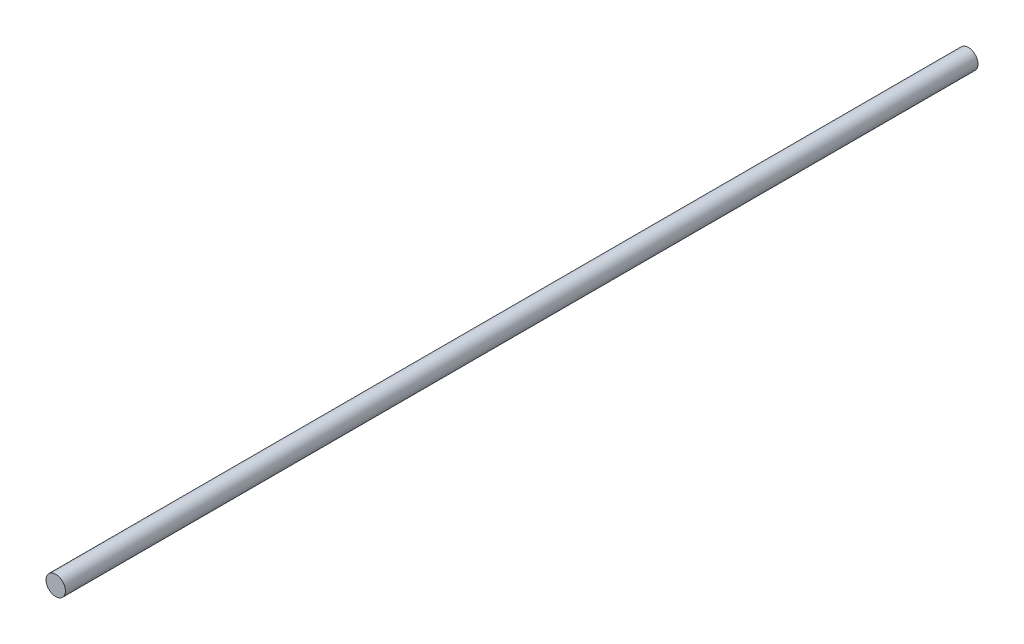
from build123d import *

# Parameters (mm, degrees)
SKETCH1_R           = 6.35
BOSS_EXTRUDE1_DEPTH = 596.9


with BuildPart() as part:
    # Sketch1 → Boss-Extrude1 (new body)
    with BuildSketch(Plane.XY):
        Circle(SKETCH1_R)
    extrude(amount=BOSS_EXTRUDE1_DEPTH)


solid = part.part
